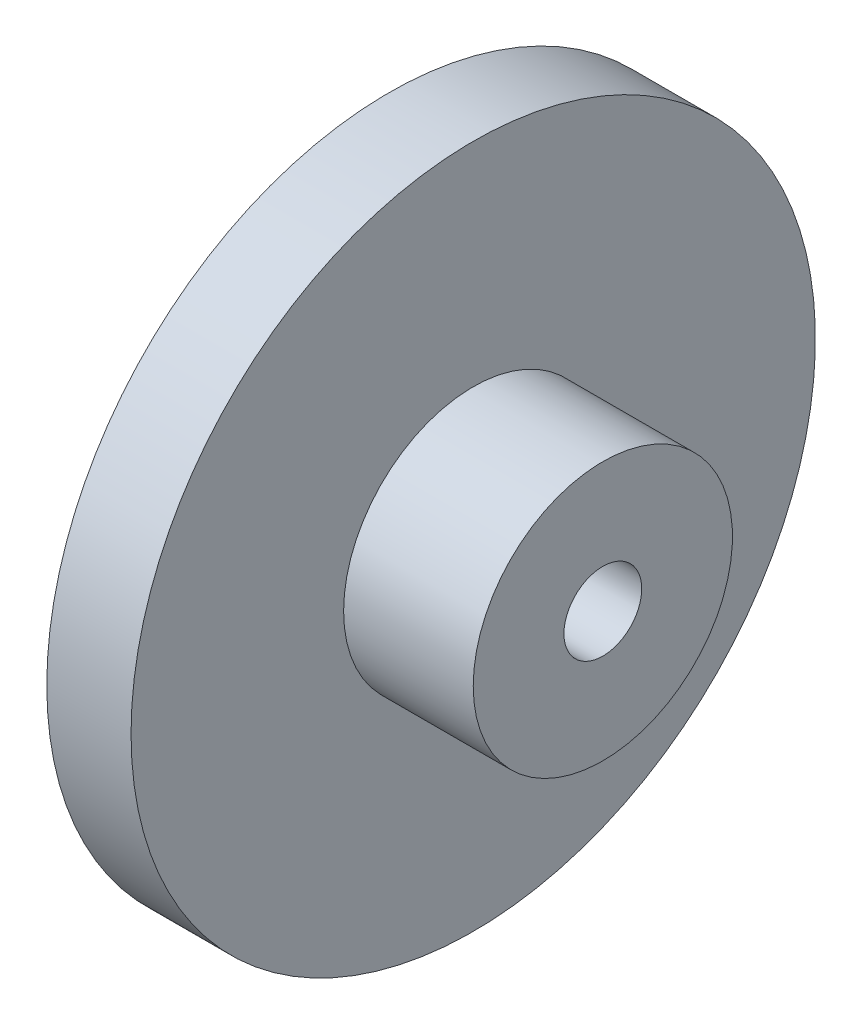
from build123d import *


with BuildPart() as part:
    # Sketch1 → Revolve1 (revolve)
    with BuildSketch(Plane(origin=(0, 0, 0), x_dir=(1, 0, 0), z_dir=(0, 1, 0)), mode=Mode.PRIVATE) as revolve1_sk:
        Polygon((0, 3), (0, 26.4), (6.5, 26.4), (6.5, 10), (16.5, 10), (16.5, 3), align=None)
    revolve(revolve1_sk.sketch.rotate(Axis((-31.608899315, 0, 0), (1, 0, 0)), 180), axis=Axis((-31.608899315, 0, 0), (1, 0, 0)))


solid = part.part
